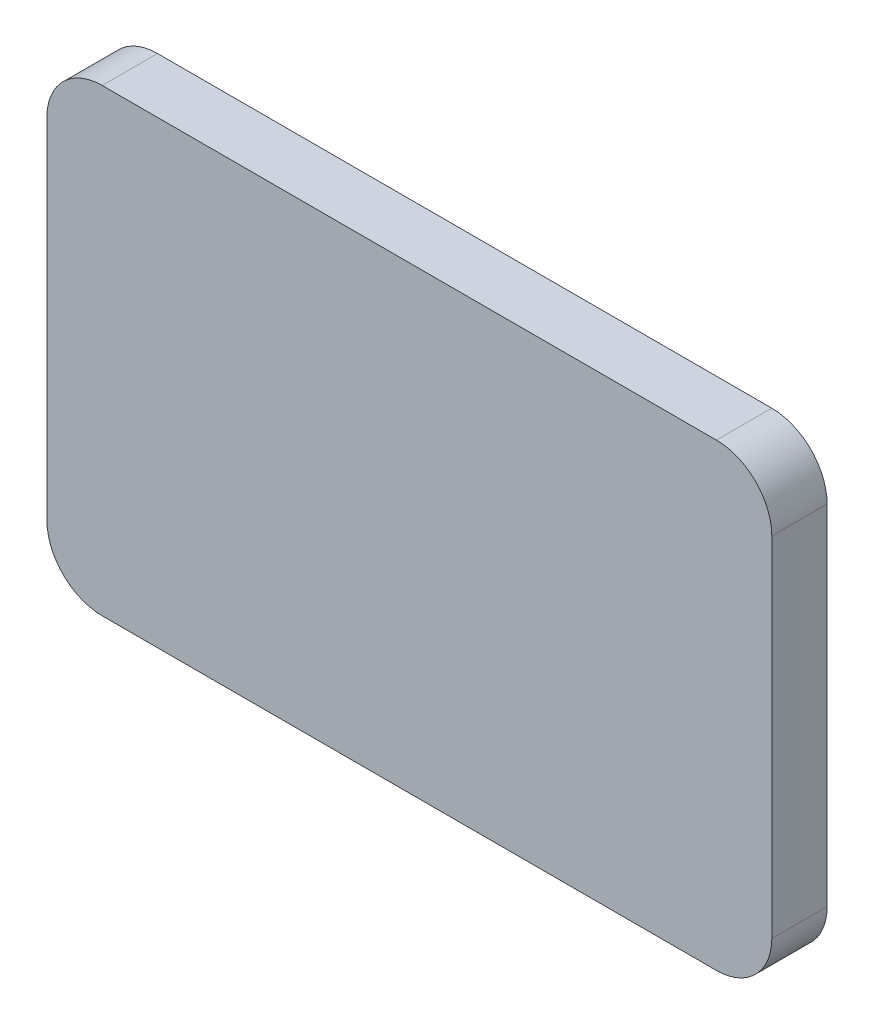
from build123d import *

# Parameters (mm, degrees)
ESQUISSE1_W        = 65.5
ESQUISSE1_H        = 41.5
BOSS_EXTRU_1_DEPTH = 5
COQUE1_T           = -3
CONG_1_R           = 5


with BuildPart() as part:
    # Esquisse1 → Boss.-Extru.1 (new body)
    with BuildSketch(Plane.XY):
        Rectangle(ESQUISSE1_W, ESQUISSE1_H)
    extrude(amount=BOSS_EXTRU_1_DEPTH)

    # Coque1
    coque1_openings = [part.faces().sort_by_distance(p)[0] for p in [
        (0, 0, 0),
    ]]
    offset(amount=COQUE1_T, openings=coque1_openings, kind=Kind.INTERSECTION)

    # Congé1
    cong_1_edges = [part.edges().sort_by_distance(p)[0] for p in [
        (29.75, -17.75, 1),
        (29.75, 17.75, 1),
        (-29.75, 17.75, 1),
        (-29.75, -17.75, 1),
        (32.75, -20.75, 2.5),
        (-32.75, -20.75, 2.5),
        (-32.75, 20.75, 2.5),
        (32.75, 20.75, 2.5),
    ]]
    fillet(cong_1_edges, radius=CONG_1_R)


solid = part.part
